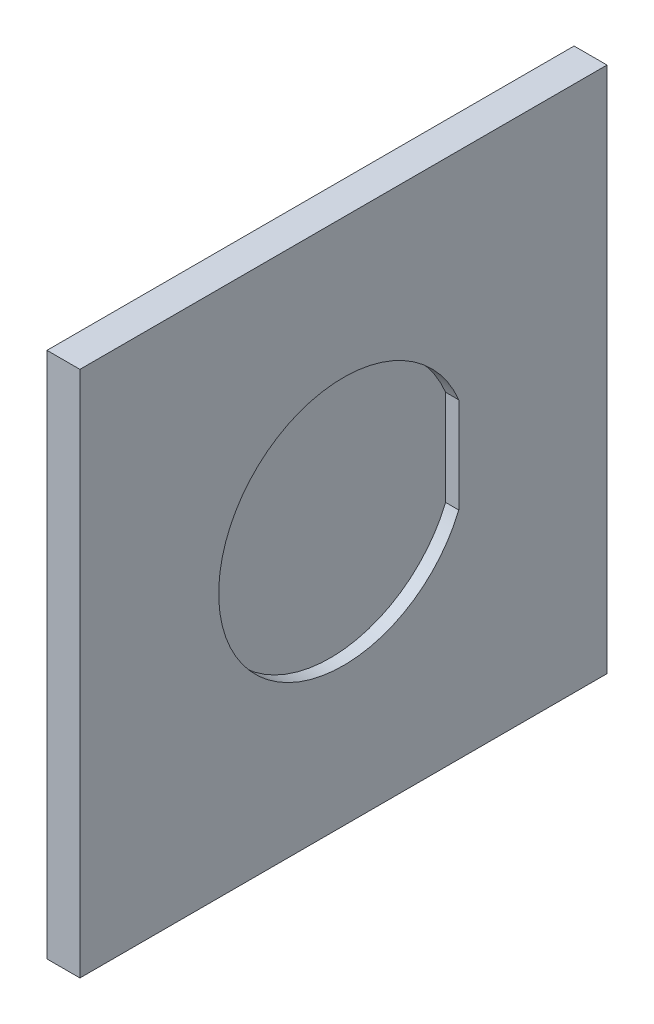
from build123d import *

# Parameters (mm, degrees)
SKETCH2_W           = 80
SKETCH2_H           = 80
BOSS_EXTRUDE1_DEPTH = 5
BOSS_EXTRUDE2_DEPTH = 1
CUT_EXTRUDE1_DEPTH  = 3


with BuildPart() as part:
    # Sketch2 → Boss-Extrude1 (new body)
    with BuildSketch(Plane(origin=(0, 0, 0), x_dir=(0, 0, -1), z_dir=(1, 0, 0))):
        with Locations((40, 40)):
            Rectangle(SKETCH2_W, SKETCH2_H)
    extrude(amount=BOSS_EXTRUDE1_DEPTH)

    # Sketch3 → Boss-Extrude2 (add)
    with BuildSketch(Plane(origin=(5, 0, 0), x_dir=(0, 0, -1), z_dir=(1, 0, 0))):
        with BuildLine():
            Line((57, 32.75895), (57, 47.24105))
            ThreePointArc((57, 47.24105), (21.522099548, 40), (57, 32.75895))
        make_face()
    extrude(amount=BOSS_EXTRUDE2_DEPTH)

    # Sketch4 → Cut-Extrude1 (cut)
    with BuildSketch(Plane(origin=(6, 0, 0), x_dir=(0, 0, -1), z_dir=(1, 0, 0))):
        with BuildLine():
            Line((57.5, 32.75895), (57.5, 47.24105))
            ThreePointArc((57.5, 47.24105), (21.061076981, 40), (57.5, 32.75895))
        make_face()
    extrude(amount=-CUT_EXTRUDE1_DEPTH, mode=Mode.SUBTRACT)


solid = part.part
